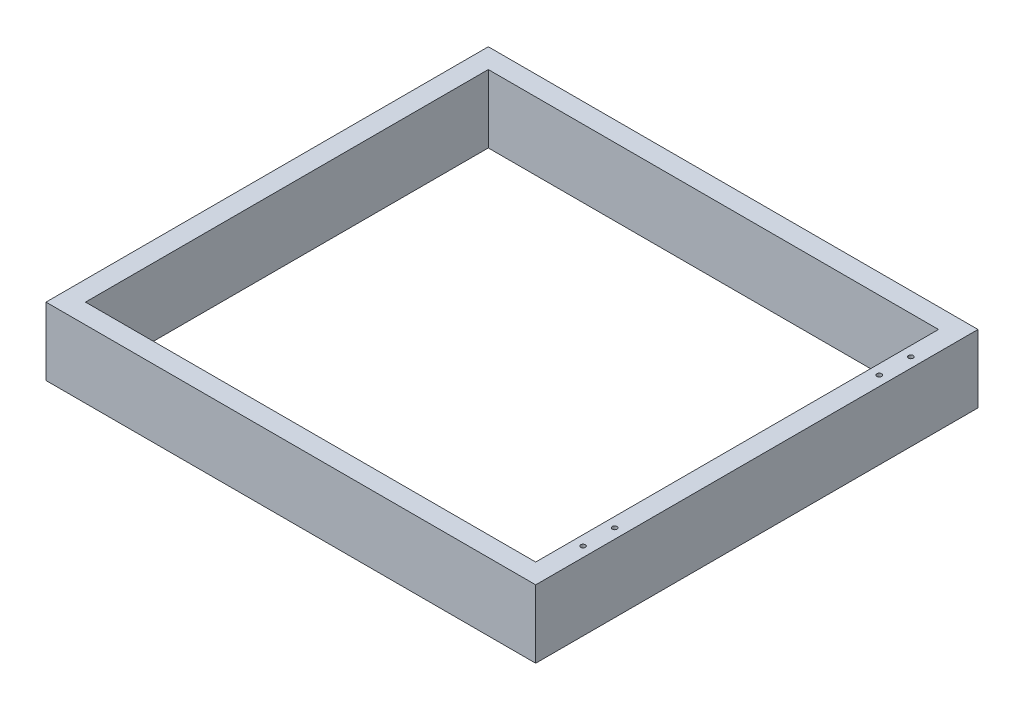
from build123d import *

# Parameters (mm, degrees)
SKETCH1_W           = 310
SKETCH1_H           = 280
SKETCH1_W_2         = 285
SKETCH1_H_2         = 255
BOSS_EXTRUDE1_DEPTH = 43
SKETCH2_R           = 1.5
CUT_EXTRUDE1_DEPTH  = 10


with BuildPart() as part:
    # Sketch1 → Boss-Extrude1 (new body)
    with BuildSketch(Plane(origin=(0, 0, 0), x_dir=(1, 0, 0), z_dir=(0, 1, 0))):
        with Locations((155, 140)):
            Rectangle(SKETCH1_W, SKETCH1_H)
        with Locations((155, 140)):
            Rectangle(SKETCH1_W_2, SKETCH1_H_2, mode=Mode.SUBTRACT)
    extrude(amount=BOSS_EXTRUDE1_DEPTH)

    # Sketch2 → Cut-Extrude1 (cut)
    with BuildSketch(Plane(origin=(0, 43, 0), x_dir=(1, 0, 0), z_dir=(0, 1, 0))):
        with Locations(Location((303.75, 243.75, 0), (0, 0, 270))):
            Circle(SKETCH2_R)
        with Locations(Location((303.75, 223.75, 0), (0, 0, 270))):
            Circle(SKETCH2_R)
        with Locations(Location((303.75, 56.25, 0), (0, 0, 270))):
            Circle(SKETCH2_R)
        with Locations(Location((303.75, 36.25, 0), (0, 0, 270))):
            Circle(SKETCH2_R)
    extrude(amount=-CUT_EXTRUDE1_DEPTH, mode=Mode.SUBTRACT)


solid = part.part
